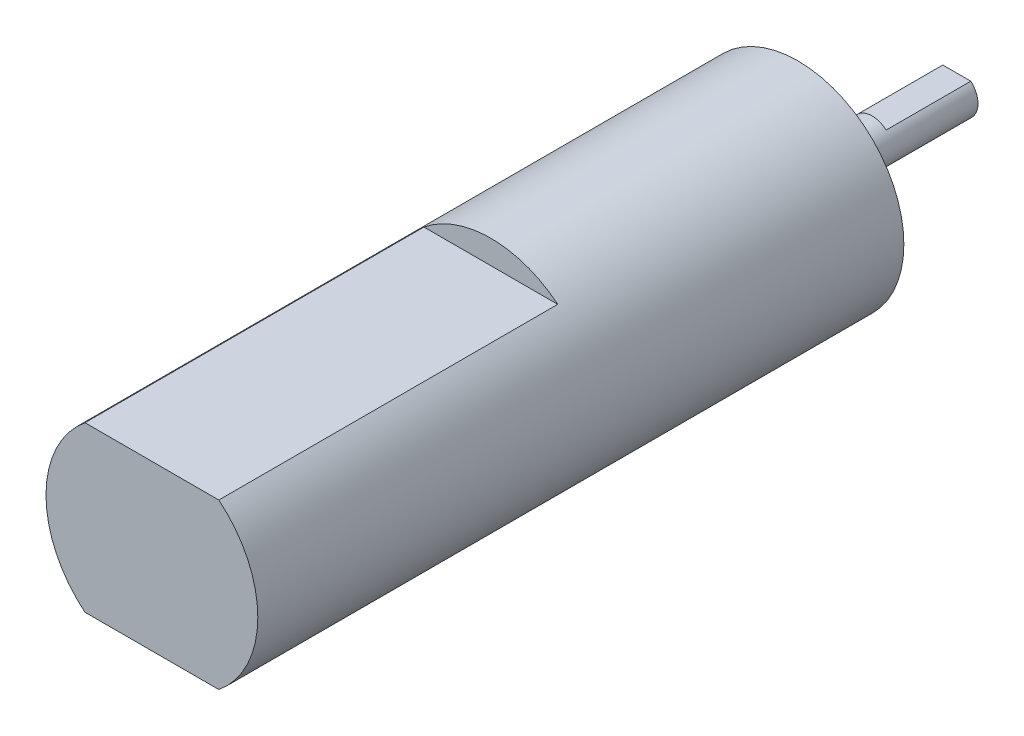
from build123d import *

# Parameters (mm, degrees)
BOSS_EXTRUDE1_DEPTH      = 32
BOSS_EXTRUDE1_DEPTH_BACK = 29
SKETCH1_R                = 10
CUT_EXTRUDE1_START       = -32
CUT_EXTRUDE1_DEPTH       = 32
SKETCH3_R                = 5
BOSS_EXTRUDE2_DEPTH      = 2
SKETCH4_R                = 2
BOSS_EXTRUDE3_DEPTH      = 13
CUT_EXTRUDE2_START       = -8
CUT_EXTRUDE2_DEPTH       = 8


with BuildPart() as part:
    # Sketch1 → Boss-Extrude1 (new, two sides: drawn at the far end of the back side and taken through both)
    with BuildSketch(Plane.XY.offset(-BOSS_EXTRUDE1_DEPTH_BACK)):
        Circle(SKETCH1_R)
    extrude(amount=BOSS_EXTRUDE1_DEPTH + BOSS_EXTRUDE1_DEPTH_BACK)

    # Sketch2 → Cut-Extrude1 (cut)
    with BuildSketch(Plane.XY.offset(32).offset(CUT_EXTRUDE1_START)):
        with BuildLine():
            Line((6.31961233, -7.75), (-6.31961233, -7.75))
            ThreePointArc((-6.31961233, -7.75), (0, -10), (6.31961233, -7.75))
        make_face()
        with BuildLine():
            ThreePointArc((6.31961233, 7.75), (0, 10), (-6.31961233, 7.75))
            Line((-6.31961233, 7.75), (6.31961233, 7.75))
        make_face()
    extrude(amount=CUT_EXTRUDE1_DEPTH, mode=Mode.SUBTRACT)

    # Sketch3 → Boss-Extrude2 (add)
    with BuildSketch(Plane(origin=(0, 0, -29), x_dir=(-1, 0, 0), z_dir=(0, 0, -1))):
        Circle(SKETCH3_R)
    extrude(amount=BOSS_EXTRUDE2_DEPTH)

    # Sketch4 → Boss-Extrude3 (add)
    with BuildSketch(Plane(origin=(0, 0, -31), x_dir=(-1, 0, 0), z_dir=(0, 0, -1))):
        with Locations(Location((0, 0, 0), (0, 0, 180))):
            Circle(SKETCH4_R)
    extrude(amount=BOSS_EXTRUDE3_DEPTH)

    # Sketch5 → Cut-Extrude2 (cut)
    with BuildSketch(Plane(origin=(0, 0, -44), x_dir=(-1, 0, 0), z_dir=(0, 0, -1)).offset(CUT_EXTRUDE2_START)):
        with BuildLine():
            Line((-1.322875656, 1.5), (1.322875656, 1.5))
            ThreePointArc((1.322875656, 1.5), (0, 2), (-1.322875656, 1.5))
        make_face()
    extrude(amount=CUT_EXTRUDE2_DEPTH, mode=Mode.SUBTRACT)


solid = part.part
